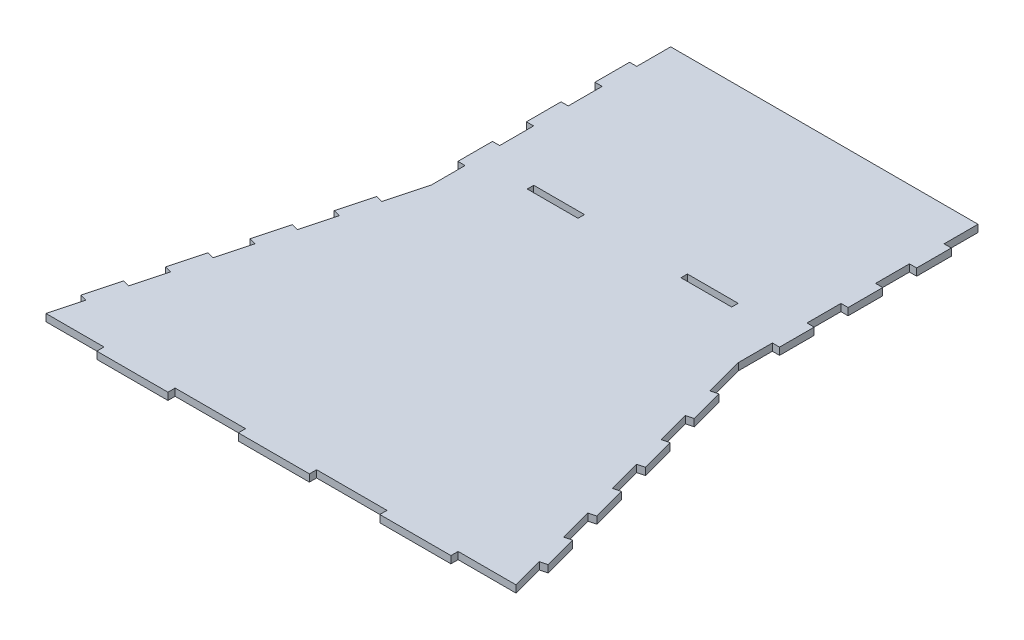
from build123d import *

# Parameters (mm, degrees)
SKETCH1_W           = 21.18343152
SKETCH1_H           = 2.7
BOSS_EXTRUDE1_DEPTH = 3


with BuildPart() as part:
    # Sketch1 → Boss-Extrude1 (new body)
    with BuildSketch(Plane(origin=(0, 0, 0), x_dir=(1, 0, 0), z_dir=(0, 1, 0))):
        Polygon((44.226000001, 0), (73.910000001, 0), (73.910000001, 3), (98.12973499, 3), (94.59216997, 16.202372389), (97.489947449, 16.978829524), (93.72803317, 31.018484749), (90.830255691, 30.242027613), (87.145987125, 43.99190509), (90.043764604, 44.768362225), (86.281850324, 58.808017449), (83.384072846, 58.031560314), (79.69980428, 71.781437791), (82.597581759, 72.557894926), (78.835667479, 86.59755015), (75.93789, 85.821093015), (72.253621435, 99.570970491), (75.151398913, 100.347427627), (71.389484634, 114.387082851), (68.491707155, 113.610625716), (64.150294558, 129.812998105), (64.150294558, 143.970140962), (67.150294558, 143.970140962), (67.150294558, 158.427283819), (64.150294558, 158.427283819), (64.150294558, 172.584426676), (67.150294558, 172.584426676), (67.150294558, 187.041569533), (64.150294558, 187.041569533), (64.150294558, 201.19871239), (67.150294558, 201.19871239), (67.150294558, 215.655855248), (64.150294558, 215.655855248), (64.150294558, 229.812998105), (-64.150294558, 229.812998105), (-64.150294558, 215.655855248), (-67.150294558, 215.655855248), (-67.150294558, 201.19871239), (-64.150294558, 201.19871239), (-64.150294558, 187.041569533), (-67.150294558, 187.041569533), (-67.150294558, 172.584426676), (-64.150294558, 172.584426676), (-64.150294558, 158.427283819), (-67.150294558, 158.427283819), (-67.150294558, 143.970140962), (-64.150294558, 143.970140962), (-64.150294558, 129.812998105), (-68.491707155, 113.610625716), (-71.389484634, 114.387082851), (-75.151398913, 100.347427627), (-72.253621435, 99.570970491), (-75.93789, 85.821093015), (-78.835667479, 86.59755015), (-82.597581759, 72.557894926), (-79.69980428, 71.781437791), (-83.384072846, 58.031560314), (-86.281850324, 58.808017449), (-90.043764604, 44.768362225), (-87.145987125, 43.99190509), (-90.830255691, 30.242027613), (-93.72803317, 31.018484749), (-97.489947449, 16.978829524), (-94.59216997, 16.202372389), (-98.12973499, 3), (-73.910000001, 3), (-73.910000001, 0), (-44.226000001, 0), (-44.226000001, 3), (-14.842, 3), (-14.842, 0), (14.842, 0), (14.842, 3), (44.226000001, 3), align=None)
        with Locations((-32.075147279, 149.812998105)):
            Rectangle(SKETCH1_W, SKETCH1_H, mode=Mode.SUBTRACT)
        with Locations((32.075147279, 149.812998105)):
            Rectangle(SKETCH1_W, SKETCH1_H, mode=Mode.SUBTRACT)
    extrude(amount=BOSS_EXTRUDE1_DEPTH)


solid = part.part
